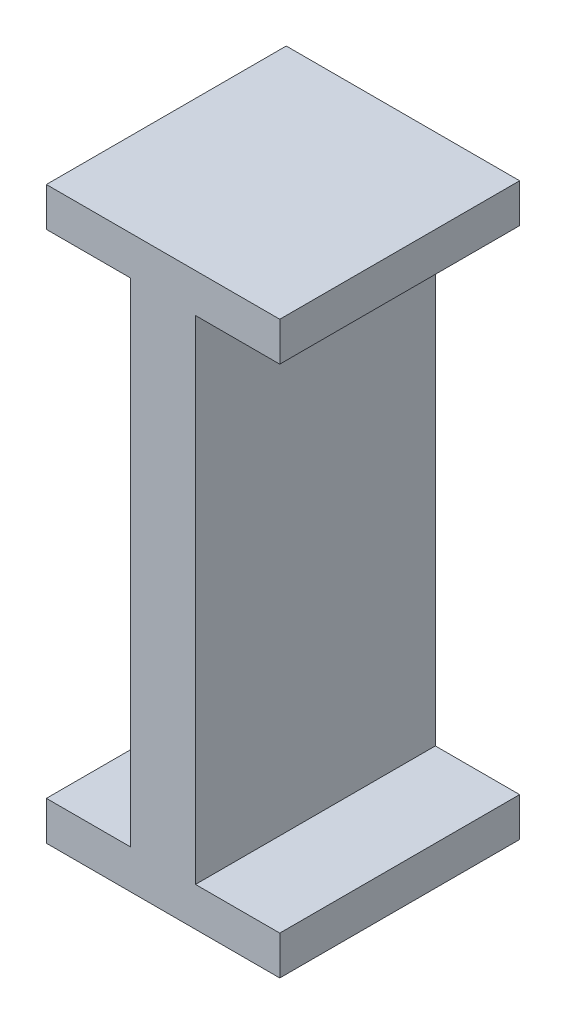
from build123d import *

# Parameters (mm, degrees)
SKETCH_1_W      = 36
SKETCH_1_H      = 37
EXTRUDE_1_DEPTH = 6
SKETCH_2_W      = 10
SKETCH_2_H      = 37
EXTRUDE_2_DEPTH = 76
SKETCH_3_W      = 36
SKETCH_3_H      = 37
EXTRUDE_3_DEPTH = 6


with BuildPart() as part:
    # 草图1 → 凸台-拉伸1 (new body)
    with BuildSketch(Plane(origin=(0, 0, 0), x_dir=(1, 0, 0), z_dir=(0, 1, 0))):
        Rectangle(SKETCH_1_W, SKETCH_1_H)
    extrude(amount=EXTRUDE_1_DEPTH)

    # 草图2 → 凸台-拉伸2 (add)
    with BuildSketch(Plane(origin=(0, 6, 0), x_dir=(1, 0, 0), z_dir=(0, 1, 0))):
        Rectangle(SKETCH_2_W, SKETCH_2_H)
    extrude(amount=EXTRUDE_2_DEPTH)

    # 草图3 → 凸台-拉伸3 (add)
    with BuildSketch(Plane(origin=(0, 82, 0), x_dir=(1, 0, 0), z_dir=(0, 1, 0))):
        Rectangle(SKETCH_3_W, SKETCH_3_H)
    extrude(amount=EXTRUDE_3_DEPTH)


solid = part.part
